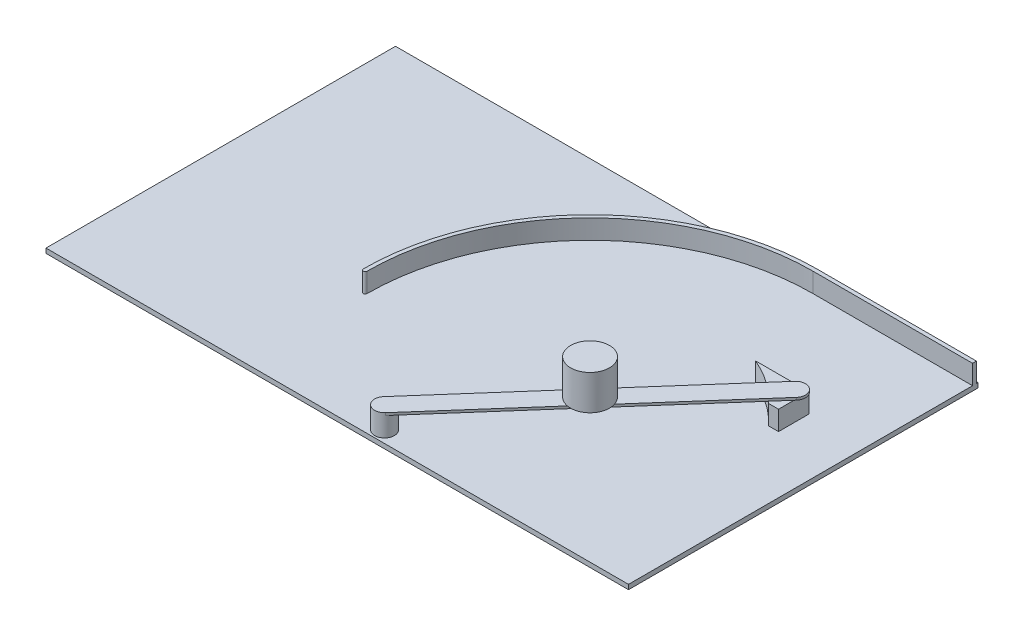
from build123d import *

# Parameters (mm, degrees)
SKETCH1_W           = 1500
SKETCH1_H           = 900
BOSS_EXTRUDE1_DEPTH = 12
BOSS_EXTRUDE2_DEPTH = 50
BOSS_EXTRUDE3_DEPTH = 50
BOSS_EXTRUDE4_DEPTH = 6.35
SKETCH5_R           = 25.4
BOSS_EXTRUDE5_DEPTH = 50
SKETCH6_R           = 50
BOSS_EXTRUDE6_DEPTH = 90


with BuildPart() as part:
    # Sketch1 → Boss-Extrude1 (new body)
    with BuildSketch(Plane(origin=(0, 0, 0), x_dir=(1, 0, 0), z_dir=(0, 1, 0))):
        Rectangle(SKETCH1_W, SKETCH1_H)
    extrude(amount=BOSS_EXTRUDE1_DEPTH)

    # Sketch2 → Boss-Extrude2 (add)
    with BuildSketch(Plane(origin=(0, 12, 0), x_dir=(1, 0, 0), z_dir=(0, 1, 0))):
        with BuildLine():
            Line((339, 436), (750, 436))
            Line((750, 436), (750, 446))
            Line((750, 446), (339, 446))
            ThreePointArc((339, 446), (-73.950360213, 274.950360213), (-245, -138))
            ThreePointArc((-245, -138), (-240, -143), (-235, -138))
            ThreePointArc((-235, -138), (-66.879292401, 267.879292401), (339, 436))
        make_face()
    extrude(amount=BOSS_EXTRUDE2_DEPTH)

    # Sketch3 → Boss-Extrude3 (add)
    with BuildSketch(Plane(origin=(0, 12, 0), x_dir=(1, 0, 0), z_dir=(0, 1, 0))):
        with BuildLine():
            Line((602.532735227, 162), (465.036343965, 162))
            ThreePointArc((465.036343965, 162), (525.239397386, 128.833369093), (577.132735227, 83.761043498))
            Line((577.132735227, 83.761043498), (602.532735227, 83.761043498))
            Line((602.532735227, 83.761043498), (602.532735227, 162))
        make_face()
    extrude(amount=BOSS_EXTRUDE3_DEPTH)

    # Sketch4 → Boss-Extrude4 (add)
    with BuildSketch(Plane(origin=(0, 62, 0), x_dir=(1, 0, 0), z_dir=(0, 1, 0))):
        with BuildLine():
            Line((72.429082424, -402.97189644), (567.405204353, 160.498279098))
            ThreePointArc((567.405204353, 160.498279098), (603.251252294, 162.81794438), (605.570917576, 126.97189644))
            Line((605.570917576, 126.97189644), (110.594795647, -436.498279098))
            ThreePointArc((110.594795647, -436.498279098), (74.748747706, -438.81794438), (72.429082424, -402.97189644))
        make_face()
    extrude(amount=BOSS_EXTRUDE4_DEPTH)

    # Sketch5 → Boss-Extrude5 (add)
    with BuildSketch(Plane(origin=(0, 12, 0), x_dir=(1, 0, 0), z_dir=(0, 1, 0))):
        with Locations(Location((91.511939036, -419.735087769, 0), (0, 0, 138.702555266))):
            Circle(SKETCH5_R)
    extrude(amount=BOSS_EXTRUDE5_DEPTH)

    # Sketch6 → Boss-Extrude6 (add)
    with BuildSketch(Plane(origin=(0, 68.35, 0), x_dir=(1, 0, 0), z_dir=(0, 1, 0))):
        with Locations(Location((339, -138, 0), (0, 0, 79.233257605))):
            Circle(SKETCH6_R)
    extrude(amount=BOSS_EXTRUDE6_DEPTH)


solid = part.part
